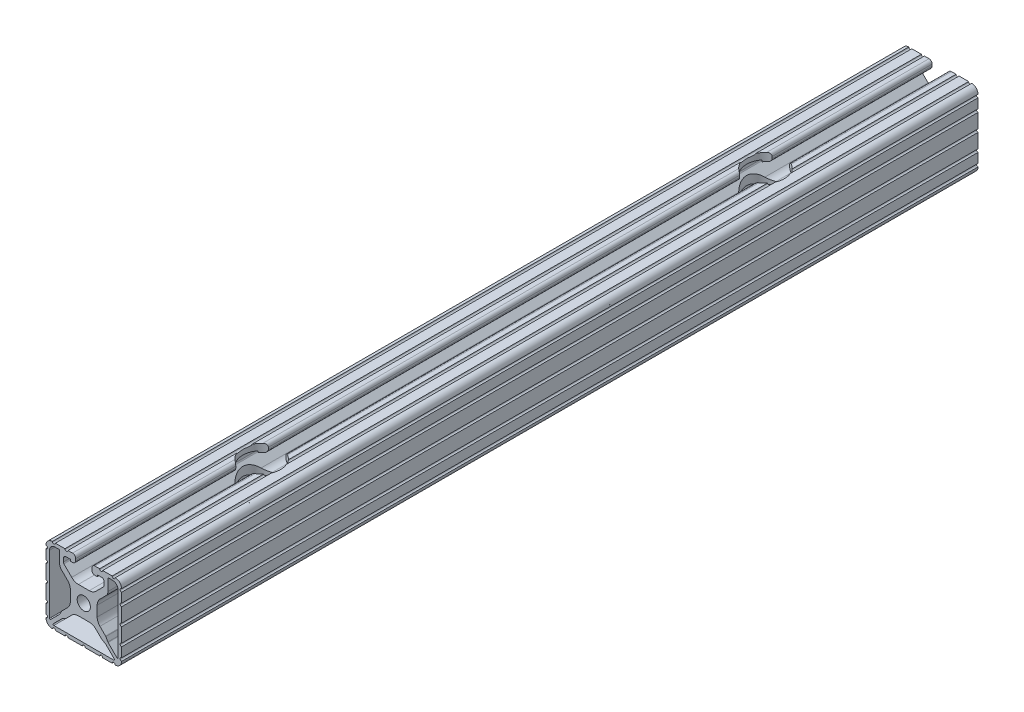
from build123d import *

# Parameters (mm, degrees)
SKETCH1_R          = 3.3274
EXTRUDE1_DEPTH     = 431.8
SKETCH2_R          = 9.525
CUT_EXTRUDE1_DEPTH = 434.896015769


with BuildPart() as part:
    # Sketch1 → Extrude1 (new body)
    with BuildSketch(Plane.XY):
        with BuildLine():
            Line((6.814144258, 15.824710921), (9.017, 15.824710921))
            ThreePointArc((9.017, 15.824710921), (9.915025612, 15.452736533), (10.287, 14.554710921))
            Line((10.287, 14.554710921), (10.287, 12.815421755))
            ThreePointArc((10.287, 12.815421755), (10.219314574, 12.47518159), (10.026564972, 12.186750874))
            Line((10.026564972, 12.186750874), (6.100754025, 8.261601293))
            ThreePointArc((6.100754025, 8.261601293), (4.55990611, 7.23218044), (2.742421178, 6.8707))
            Line((2.742421178, 6.8707), (-2.742421178, 6.8707))
            ThreePointArc((-2.742421178, 6.8707), (-4.55990611, 7.23218044), (-6.100754025, 8.261601293))
            Line((-6.100754025, 8.261601293), (-10.026564972, 12.186750874))
            ThreePointArc((-10.026564972, 12.186750874), (-10.219314574, 12.47518159), (-10.287, 12.815421755))
            Line((-10.287, 12.815421755), (-10.287, 14.554710921))
            ThreePointArc((-10.287, 14.554710921), (-9.915025612, 15.452736533), (-9.017, 15.824710921))
            Line((-9.017, 15.824710921), (-6.814144258, 15.824710921))
            Line((-6.814144258, 15.824710921), (-6.814144258, 14.986))
            Line((-6.814144258, 14.986), (-5.6388, 14.986))
            ThreePointArc((-5.6388, 14.986), (-4.525248241, 15.447248241), (-4.064, 16.5608))
            Line((-4.064, 16.5608), (-4.064, 17.4752))
            ThreePointArc((-4.064, 17.4752), (-4.525248241, 18.588751759), (-5.6388, 19.05))
            Line((-5.6388, 19.05), (-7.9756, 19.05))
            ThreePointArc((-7.9756, 19.05), (-8.7376, 18.288), (-9.4996, 19.05))
            Line((-9.4996, 19.05), (-14.3256, 19.05))
            ThreePointArc((-14.3256, 19.05), (-15.0876, 18.288), (-15.8496, 19.05))
            Line((-15.8496, 19.05), (-15.875, 19.05))
            ThreePointArc((-15.875, 19.05), (-18.12006403, 18.12006403), (-19.05, 15.875))
            Line((-19.05, 15.875), (-19.05, 15.8496))
            ThreePointArc((-19.05, 15.8496), (-18.288, 15.0876), (-19.05, 14.3256))
            Line((-19.05, 14.3256), (-19.05, 9.4996))
            ThreePointArc((-19.05, 9.4996), (-18.288, 8.7376), (-19.05, 7.9756))
            Line((-19.05, 7.9756), (-19.05, 0.762))
            ThreePointArc((-19.05, 0.762), (-18.288, 0), (-19.05, -0.762))
            Line((-19.05, -0.762), (-19.05, -7.9756))
            ThreePointArc((-19.05, -7.9756), (-18.288, -8.7376), (-19.05, -9.4996))
            Line((-19.05, -9.4996), (-19.05, -14.3256))
            ThreePointArc((-19.05, -14.3256), (-18.288, -15.0876), (-19.05, -15.8496))
            Line((-19.05, -15.8496), (-19.05, -15.875))
            ThreePointArc((-19.05, -15.875), (-18.12006403, -18.12006403), (-15.875, -19.05))
            Line((-15.875, -19.05), (-15.8496, -19.05))
            ThreePointArc((-15.8496, -19.05), (-15.0876, -18.288), (-14.3256, -19.05))
            Line((-14.3256, -19.05), (-9.4996, -19.05))
            ThreePointArc((-9.4996, -19.05), (-8.7376, -18.288), (-7.9756, -19.05))
            Line((-7.9756, -19.05), (-0.762, -19.05))
            ThreePointArc((-0.762, -19.05), (0, -18.288), (0.762, -19.05))
            Line((0.762, -19.05), (7.9756, -19.05))
            ThreePointArc((7.9756, -19.05), (8.7376, -18.288), (9.4996, -19.05))
            Line((9.4996, -19.05), (14.3256, -19.05))
            ThreePointArc((14.3256, -19.05), (15.0876, -18.288), (15.8496, -19.05))
            Line((15.8496, -19.05), (15.875, -19.05))
            ThreePointArc((15.875, -19.05), (18.12006403, -18.12006403), (19.05, -15.875))
            Line((19.05, -15.875), (19.05, -15.8496))
            ThreePointArc((19.05, -15.8496), (18.288, -15.0876), (19.05, -14.3256))
            Line((19.05, -14.3256), (19.05, -9.4996))
            ThreePointArc((19.05, -9.4996), (18.288, -8.7376), (19.05, -7.9756))
            Line((19.05, -7.9756), (19.05, -0.762))
            ThreePointArc((19.05, -0.762), (18.288, 0), (19.05, 0.762))
            Line((19.05, 0.762), (19.05, 7.9756))
            ThreePointArc((19.05, 7.9756), (18.288, 8.7376), (19.05, 9.4996))
            Line((19.05, 9.4996), (19.05, 14.3256))
            ThreePointArc((19.05, 14.3256), (18.288, 15.0876), (19.05, 15.8496))
            Line((19.05, 15.8496), (19.05, 15.875))
            ThreePointArc((19.05, 15.875), (18.12006403, 18.12006403), (15.875, 19.05))
            Line((15.875, 19.05), (15.8496, 19.05))
            ThreePointArc((15.8496, 19.05), (15.0876, 18.288), (14.3256, 19.05))
            Line((14.3256, 19.05), (9.4996, 19.05))
            ThreePointArc((9.4996, 19.05), (8.7376, 18.288), (7.9756, 19.05))
            Line((7.9756, 19.05), (5.6388, 19.05))
            ThreePointArc((5.6388, 19.05), (4.525248241, 18.588751759), (4.064, 17.4752))
            Line((4.064, 17.4752), (4.064, 16.5608))
            ThreePointArc((4.064, 16.5608), (4.525248241, 15.447248241), (5.6388, 14.986))
            Line((5.6388, 14.986), (6.814144258, 14.986))
            Line((6.814144258, 14.986), (6.814144258, 15.824710921))
        make_face()
        Circle(SKETCH1_R, mode=Mode.SUBTRACT)
        with BuildLine():
            Line((17.272, -15.193619561), (17.272, 14.478))
            ThreePointArc((17.272, 14.478), (16.453656347, 16.453656347), (14.478, 17.272))
            Line((14.478, 17.272), (12.554627238, 17.272))
            ThreePointArc((12.554627238, 17.272), (12.285219554, 17.160407684), (12.173627238, 16.891))
            Line((12.173627238, 16.891), (12.173627238, 11.224276306))
            ThreePointArc((12.173627238, 11.224276306), (11.931893574, 10.009132858), (11.243502135, 8.979023159))
            Line((11.243502135, 8.979023159), (8.147867153, 5.883909687))
            ThreePointArc((8.147867153, 5.883909687), (7.118033561, 4.342865578), (6.7564, 2.525010979))
            Line((6.7564, 2.525010979), (6.7564, -2.638829998))
            ThreePointArc((6.7564, -2.638829998), (7.117934192, -4.456444709), (8.147499936, -5.99736151))
            Line((8.147499936, -5.99736151), (10.978133922, -8.828137555))
            ThreePointArc((10.978133922, -8.828137555), (11.047042355, -8.907266312), (11.104427332, -8.995111041))
            Line((11.104427332, -8.995111041), (12.13998256, -10.847500325))
            ThreePointArc((12.13998256, -10.847500325), (12.197373304, -10.935352679), (12.266289489, -11.014487331))
            Line((12.266289489, -11.014487331), (16.687520892, -15.435718734))
            ThreePointArc((16.687520892, -15.435718734), (17.060643194, -15.509937374), (17.272, -15.193619561))
        make_face(mode=Mode.SUBTRACT)
        with BuildLine():
            Line((-12.173627238, 11.224276306), (-12.173627238, 16.891))
            ThreePointArc((-12.173627238, 16.891), (-12.285219554, 17.160407684), (-12.554627238, 17.272))
            Line((-12.554627238, 17.272), (-14.478, 17.272))
            ThreePointArc((-14.478, 17.272), (-16.453656347, 16.453656347), (-17.272, 14.478))
            Line((-17.272, 14.478), (-17.272, -15.193619561))
            ThreePointArc((-17.272, -15.193619561), (-17.060643194, -15.509937374), (-16.687520892, -15.435718734))
            Line((-16.687520892, -15.435718734), (-12.266289488, -11.014487333))
            ThreePointArc((-12.266289488, -11.014487333), (-12.197373302, -10.935352681), (-12.139982558, -10.847500326))
            Line((-12.139982558, -10.847500326), (-11.104427331, -8.995111042))
            ThreePointArc((-11.104427331, -8.995111042), (-11.047042353, -8.907266313), (-10.978133921, -8.828137556))
            Line((-10.978133921, -8.828137556), (-8.147499934, -5.997361511))
            ThreePointArc((-8.147499934, -5.997361511), (-7.11793419, -4.45644471), (-6.756399998, -2.638829999))
            Line((-6.756399998, -2.638829999), (-6.756399998, 2.525010979))
            ThreePointArc((-6.756399998, 2.525010979), (-7.118033559, 4.342865578), (-8.147867152, 5.883909688))
            Line((-8.147867152, 5.883909688), (-11.243502135, 8.979023158))
            ThreePointArc((-11.243502135, 8.979023158), (-11.931893574, 10.009132857), (-12.173627238, 11.224276306))
        make_face(mode=Mode.SUBTRACT)
        with BuildLine():
            Line((15.358897182, -16.621566737), (11.090984974, -12.353654529))
            ThreePointArc((11.090984974, -12.353654529), (11.011857946, -12.284744111), (10.924014656, -12.227356929))
            Line((10.924014656, -12.227356929), (9.072208991, -11.192066981))
            ThreePointArc((9.072208991, -11.192066981), (8.984358076, -11.134674031), (8.905225153, -11.06575586))
            Line((8.905225153, -11.06575586), (6.101578488, -8.261968492))
            ThreePointArc((6.101578488, -8.261968492), (4.560603247, -7.232279806), (2.742878424, -6.870700004))
            Line((2.742878424, -6.870700004), (-2.742878422, -6.870700004))
            ThreePointArc((-2.742878422, -6.870700004), (-4.560603245, -7.232279806), (-6.101578486, -8.261968491))
            Line((-6.101578486, -8.261968491), (-8.905225151, -11.06575586))
            ThreePointArc((-8.905225151, -11.06575586), (-8.984358074, -11.134674031), (-9.072208989, -11.19206698))
            Line((-9.072208989, -11.19206698), (-10.924014654, -12.227356929))
            ThreePointArc((-10.924014654, -12.227356929), (-11.011857944, -12.284744111), (-11.090984971, -12.353654529))
            Line((-11.090984971, -12.353654529), (-15.35889718, -16.621566737))
            ThreePointArc((-15.35889718, -16.621566737), (-15.441490846, -17.036793139), (-15.0894789, -17.272000001))
            Line((-15.0894789, -17.272000001), (15.089478903, -17.272000001))
            ThreePointArc((15.089478903, -17.272000001), (15.441490849, -17.036793139), (15.358897182, -16.621566737))
        make_face(mode=Mode.SUBTRACT)
    extrude(amount=-EXTRUDE1_DEPTH)

    # Sketch2 → Cut-Extrude1 (cut, through all)
    with BuildSketch(Plane.XZ.offset(19.05)):
        with Locations(Location((0.762, -88.9, 0), (0, 0, 282.000383265))):
            Circle(SKETCH2_R)
        with Locations(Location((0.762, -342.9, 0), (0, 0, 282.000383265))):
            Circle(SKETCH2_R)
    extrude(amount=-CUT_EXTRUDE1_DEPTH, mode=Mode.SUBTRACT)


solid = part.part
